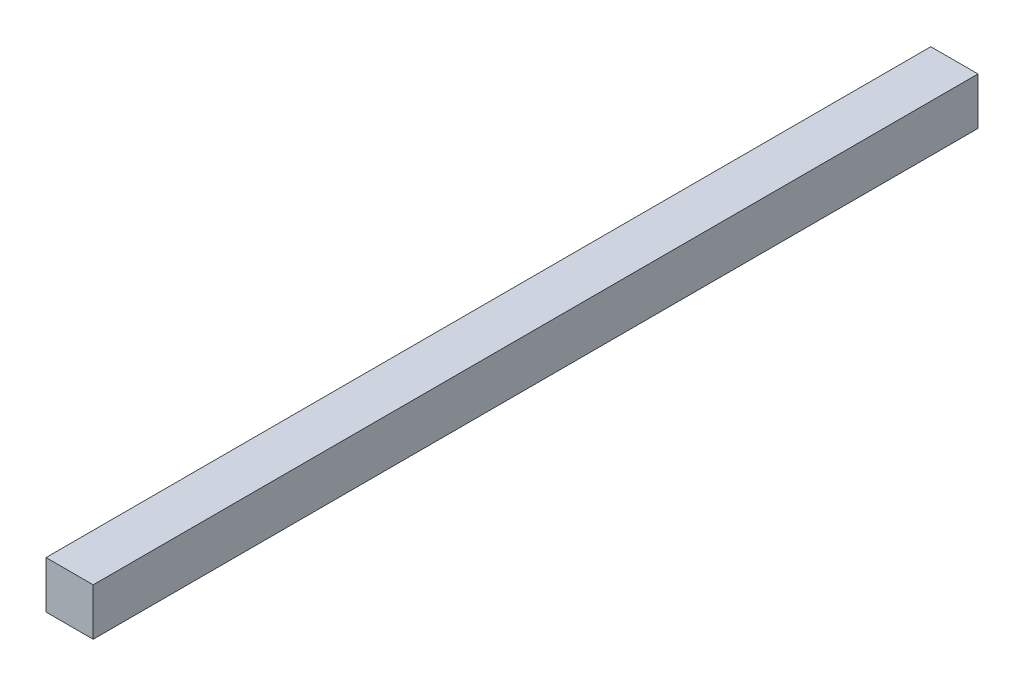
from build123d import *

# Parameters (mm, degrees)
ESQUISSE1_W        = 16
ESQUISSE1_H        = 16
BOSS_EXTRU_1_DEPTH = 300


with BuildPart() as part:
    # Esquisse1 → Boss.-Extru.1 (new body)
    with BuildSketch(Plane.XY):
        with Locations((8, 8)):
            Rectangle(ESQUISSE1_W, ESQUISSE1_H)
    extrude(amount=BOSS_EXTRU_1_DEPTH)


solid = part.part
